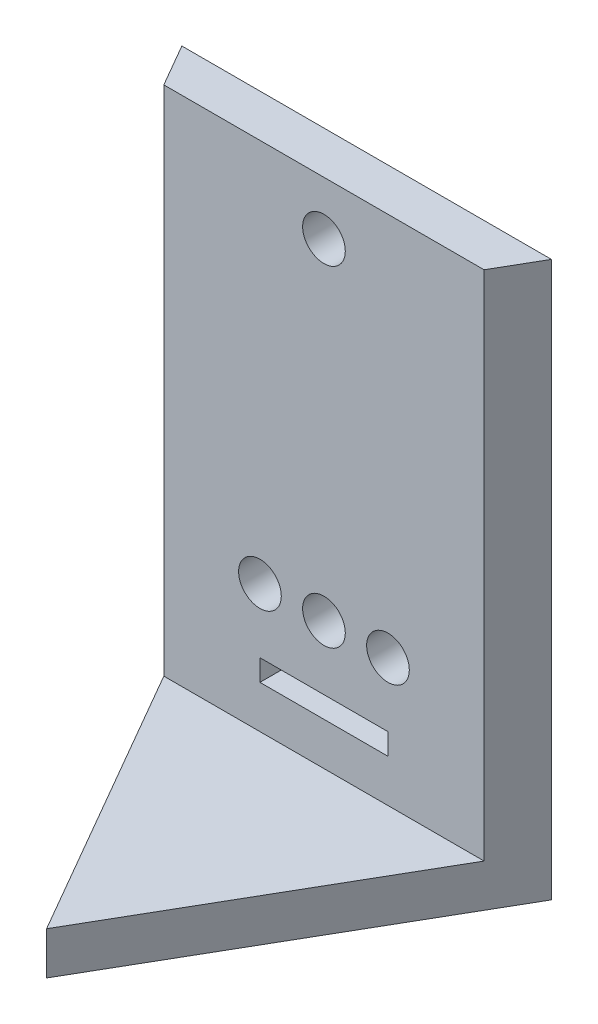
from build123d import *

# Parameters (mm, degrees)
MAIN_FRAME_DEPTH     = 130
SHELL1_T             = -10
CUT_EXTRUDE1_DEPTH   = 174.277234512
EXTERNAL_PORTS_REACH = 158.205
SKETCH5_R            = 5
SKETCH5_W            = 30
SKETCH5_H            = 5
SKETCH7_R            = 1.25


with BuildPart() as part:
    # Sketch1 → Main Frame (new body)
    with BuildSketch(Plane(origin=(0, 0, 0), x_dir=(1, 0, 0), z_dir=(0, 1, 0))):
        Polygon((86.602540378, 0), (43.301270189, 75), (-43.301270189, 75), (-86.602540378, 0), (-43.301270189, -75), (43.301270189, -75), align=None)
    extrude(amount=MAIN_FRAME_DEPTH)

    # Shell1
    shell1_openings = [part.faces().sort_by_distance(p)[0] for p in [
        (0, 130, 0),
    ]]
    offset(amount=SHELL1_T, openings=shell1_openings, kind=Kind.INTERSECTION)

    # Sketch2 → Cut-Extrude1 (cut, through all)
    with BuildSketch(Plane(origin=(0, 130, 0), x_dir=(1, 0, 0), z_dir=(0, 1, 0))):
        Polygon((-43.301270189, 75), (0, 0), (43.301270189, 75), (86.602540378, 0), (43.301270189, -75), (-43.301270189, -75), (-86.602540378, 0), align=None)
    extrude(amount=-CUT_EXTRUDE1_DEPTH, mode=Mode.SUBTRACT)

    # Sketch5 → External Ports (cut, up to next)
    with BuildSketch(Plane(origin=(0, 0, -75), x_dir=(-1, 0, 0), z_dir=(0, 0, -1)), mode=Mode.PRIVATE) as external_ports_sk1:
        with Locations((-15, 40)):
            Circle(SKETCH5_R)
    external_ports_tool1 = extrude(external_ports_sk1.sketch, amount=-EXTERNAL_PORTS_REACH, mode=Mode.PRIVATE) & part.part
    # Sketch5 → External Ports (cut, up to next)
    with BuildSketch(Plane(origin=(0, 0, -75), x_dir=(-1, 0, 0), z_dir=(0, 0, -1)), mode=Mode.PRIVATE) as external_ports_sk2:
        with Locations((0, 40)):
            Circle(SKETCH5_R)
    external_ports_tool2 = extrude(external_ports_sk2.sketch, amount=-EXTERNAL_PORTS_REACH, mode=Mode.PRIVATE) & part.part
    # Sketch5 → External Ports (cut, up to next)
    with BuildSketch(Plane(origin=(0, 0, -75), x_dir=(-1, 0, 0), z_dir=(0, 0, -1)), mode=Mode.PRIVATE) as external_ports_sk3:
        with Locations((15, 40)):
            Circle(SKETCH5_R)
    external_ports_tool3 = extrude(external_ports_sk3.sketch, amount=-EXTERNAL_PORTS_REACH, mode=Mode.PRIVATE) & part.part
    # Sketch5 → External Ports (cut, up to next)
    with BuildSketch(Plane(origin=(0, 0, -75), x_dir=(-1, 0, 0), z_dir=(0, 0, -1)), mode=Mode.PRIVATE) as external_ports_sk4:
        with Locations((0, 117.5)):
            Circle(SKETCH5_R)
    external_ports_tool4 = extrude(external_ports_sk4.sketch, amount=-EXTERNAL_PORTS_REACH, mode=Mode.PRIVATE) & part.part
    # Sketch5 → External Ports (cut, up to next)
    with BuildSketch(Plane(origin=(0, 0, -75), x_dir=(-1, 0, 0), z_dir=(0, 0, -1)), mode=Mode.PRIVATE) as external_ports_sk5:
        with Locations((0, 22.5)):
            Rectangle(SKETCH5_W, SKETCH5_H)
    external_ports_tool5 = extrude(external_ports_sk5.sketch, amount=-EXTERNAL_PORTS_REACH, mode=Mode.PRIVATE) & part.part
    add(external_ports_tool1.solids().sort_by_distance((15, 40, -75))[0], mode=Mode.SUBTRACT)
    add(external_ports_tool2.solids().sort_by_distance((0, 40, -75))[0], mode=Mode.SUBTRACT)
    add(external_ports_tool3.solids().sort_by_distance((-15, 40, -75))[0], mode=Mode.SUBTRACT)
    add(external_ports_tool4.solids().sort_by_distance((0, 117.5, -75))[0], mode=Mode.SUBTRACT)
    add(external_ports_tool5.solids().sort_by_distance((0, 22.5, -75))[0], mode=Mode.SUBTRACT)

    # Boom Mount: sweep along a path in Sketch6
    with BuildLine(Plane(origin=(10, 0, 0), x_dir=(0, 0, -1), z_dir=(1, 0, 0))) as boom_mount_path:
        Line((75, 110), (77, 110))
        ThreePointArc((77, 110), (79.121320344, 109.121320344), (80, 107))
        Line((80, 107), (80, 88))
        ThreePointArc((80, 88), (79.121320344, 85.878679656), (77, 85))
        Line((77, 85), (75, 85))
    # Sketch7 → Boom Mount (sweep)
    with BuildSketch(Plane(origin=(0, 0, -75), x_dir=(-1, 0, 0), z_dir=(0, 0, -1))):
        with Locations((-10, 110)):
            Circle(SKETCH7_R)
    boom_mount = sweep(path=boom_mount_path.line)

    # Mirror1: Boom Mount across plane
    add(boom_mount.mirror(Plane(origin=(0, 0, 0), x_dir=(0, 0, 1), z_dir=(1, 0, 0))))


solid = part.part
